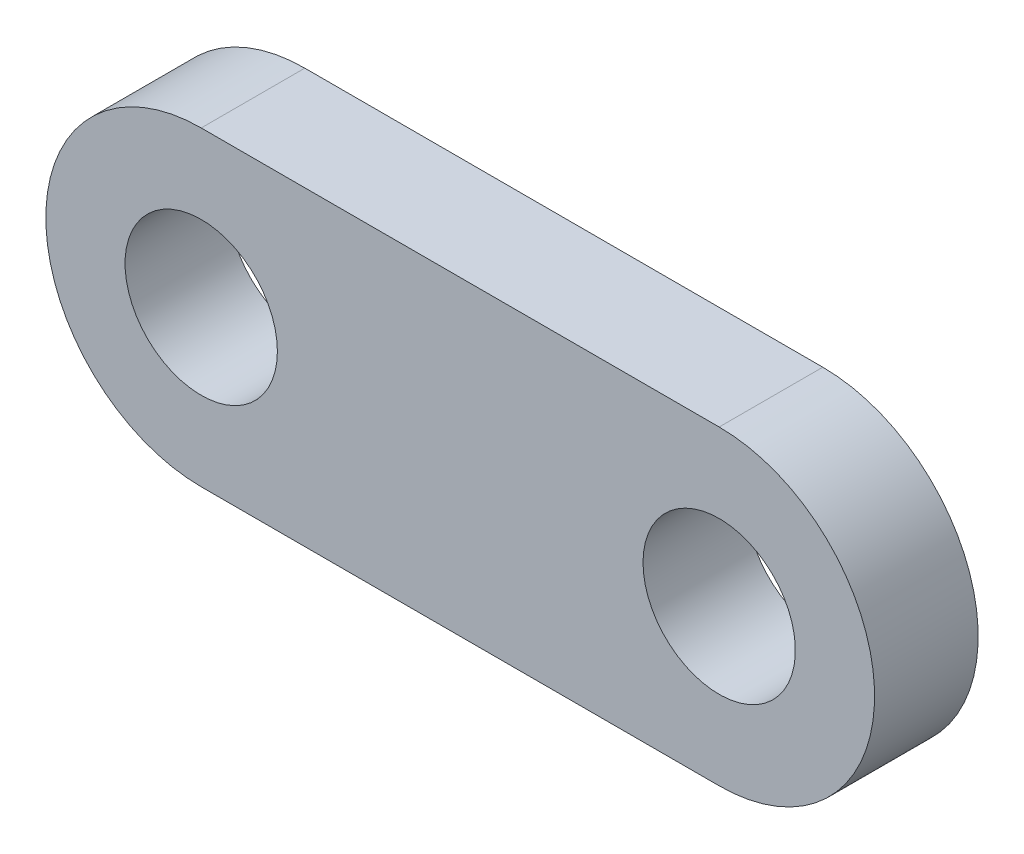
from build123d import *

# Parameters (mm, degrees)
SKETCH1_W           = 50
SKETCH1_H           = 30
BOSS_EXTRUDE2_DEPTH = 10
BOSS_EXTRUDE3_DEPTH = 10
BOSS_EXTRUDE4_DEPTH = 10
SKETCH6_R           = 7.353544845
CUT_EXTRUDE1_DEPTH  = 10


with BuildPart() as part:
    # Sketch1 → Boss-Extrude2 (new body)
    with BuildSketch(Plane.XY):
        with Locations((0, -15)):
            Rectangle(SKETCH1_W, SKETCH1_H)
    extrude(amount=BOSS_EXTRUDE2_DEPTH)

    # Sketch4 → Boss-Extrude3 (add)
    with BuildSketch(Plane.XY.offset(10)):
        with BuildLine():
            Line((25, 0), (25, -30))
            ThreePointArc((25, -30), (40, -15), (25, 0))
        make_face()
    extrude(amount=-BOSS_EXTRUDE3_DEPTH)

    # Sketch5 → Boss-Extrude4 (add)
    with BuildSketch(Plane.XY.offset(10)):
        with BuildLine():
            Line((-25, 0), (-25, -30))
            ThreePointArc((-25, -30), (-40, -15), (-25, 0))
        make_face()
    extrude(amount=-BOSS_EXTRUDE4_DEPTH)

    # Sketch6 → Cut-Extrude1 (cut)
    with BuildSketch(Plane.XY.offset(10)):
        with Locations((-25, -15)):
            Circle(SKETCH6_R)
        with Locations(Location((25, -15, 0), (0, 0, 180))):
            Circle(SKETCH6_R)
    extrude(amount=-CUT_EXTRUDE1_DEPTH, mode=Mode.SUBTRACT)


solid = part.part
